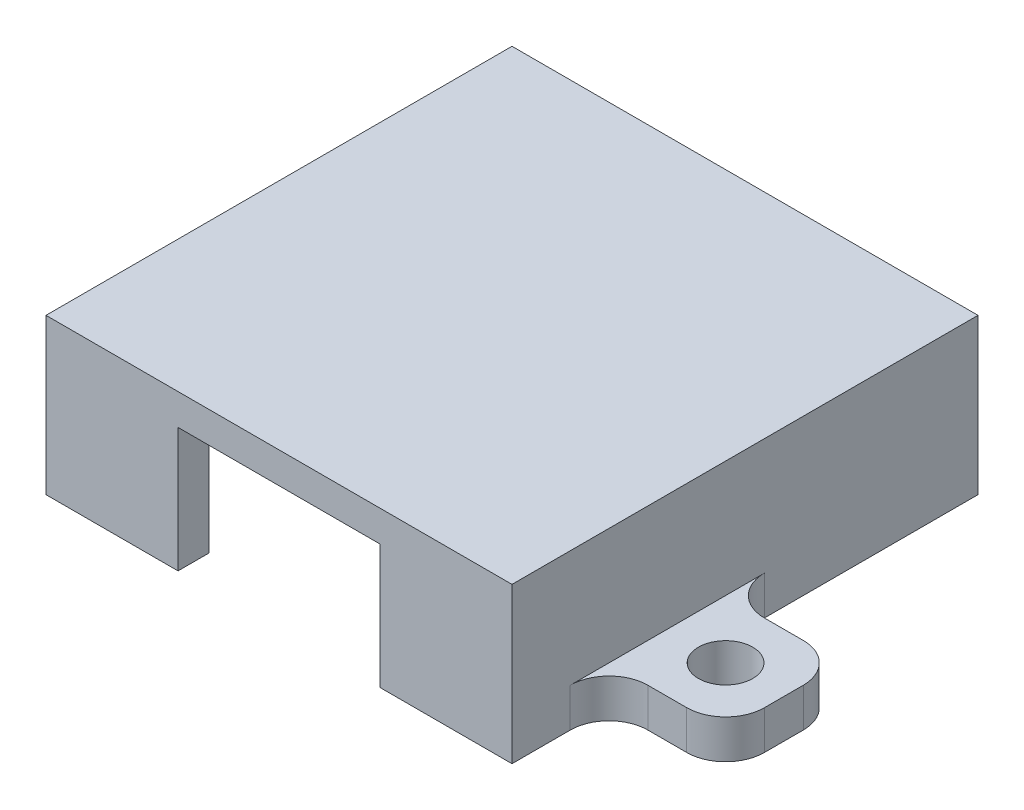
from build123d import *

# Parameters (mm, degrees)
SKETCH1_W           = 30
SKETCH1_H           = 30
BOSS_EXTRUDE1_DEPTH = 10
CUT_EXTRUDE1_DEPTH  = 8
SKETCH3_W           = 7.5
SKETCH3_H           = 2.5
BOSS_EXTRUDE2_DEPTH = 7.5
SKETCH4_R           = 1.75
CUT_EXTRUDE2_DEPTH  = 44.084219849
FILLET1_R           = 2.5
FILLET2_R           = 2.5


with BuildPart() as part:
    # Sketch1 → Boss-Extrude1 (new body)
    with BuildSketch(Plane(origin=(0, 0, 0), x_dir=(1, 0, 0), z_dir=(0, 1, 0))):
        with Locations((15, 15)):
            Rectangle(SKETCH1_W, SKETCH1_H)
    extrude(amount=BOSS_EXTRUDE1_DEPTH)

    # Sketch2 → Cut-Extrude1 (cut)
    with BuildSketch(Plane.XZ):
        Polygon((8.5, 0), (21.5, 0), (21.5, -2), (28, -2), (28, -28), (28, -30), (22, -30), (22, -28), (8, -28), (8, -30), (2, -30), (2, -28), (2, -2), (8.5, -2), align=None)
    extrude(amount=-CUT_EXTRUDE1_DEPTH, mode=Mode.SUBTRACT)

    # Sketch3 → Boss-Extrude2 (add)
    with BuildSketch(Plane.ZY):
        with Locations((-10, 1.25)):
            Rectangle(SKETCH3_W, SKETCH3_H)
    boss_extrude2 = extrude(amount=BOSS_EXTRUDE2_DEPTH)

    # Sketch4 → Cut-Extrude2 (cut, through all)
    with BuildSketch(Plane(origin=(0, 2.5, 0), x_dir=(1, 0, 0), z_dir=(0, 1, 0))):
        with Locations(Location((-3.75, 10, 0), (0, 0, 270))):
            Circle(SKETCH4_R)
    cut_extrude2 = extrude(amount=-CUT_EXTRUDE2_DEPTH, mode=Mode.SUBTRACT)

    # Fillet1
    fillet1_edges = [part.edges().sort_by_distance(p)[0] for p in [
        (0, 1.25, -6.25),
        (0, 1.25, -13.75),
        (-7.5, 1.25, -6.25),
        (-7.5, 1.25, -13.75),
    ]]
    fillet(fillet1_edges, radius=FILLET1_R)

    # Mirror1: Boss-Extrude2, Cut-Extrude2 across plane
    add(boss_extrude2.mirror(Plane.ZY.offset(-15)))
    add(cut_extrude2.mirror(Plane.ZY.offset(-15)), mode=Mode.SUBTRACT)

    # Fillet2
    fillet2_edges = [part.edges().sort_by_distance(p)[0] for p in [
        (37.5, 1.25, -6.25),
        (37.5, 1.25, -13.75),
        (30, 1.25, -6.25),
        (30, 1.25, -13.75),
    ]]
    fillet(fillet2_edges, radius=FILLET2_R)


solid = part.part
